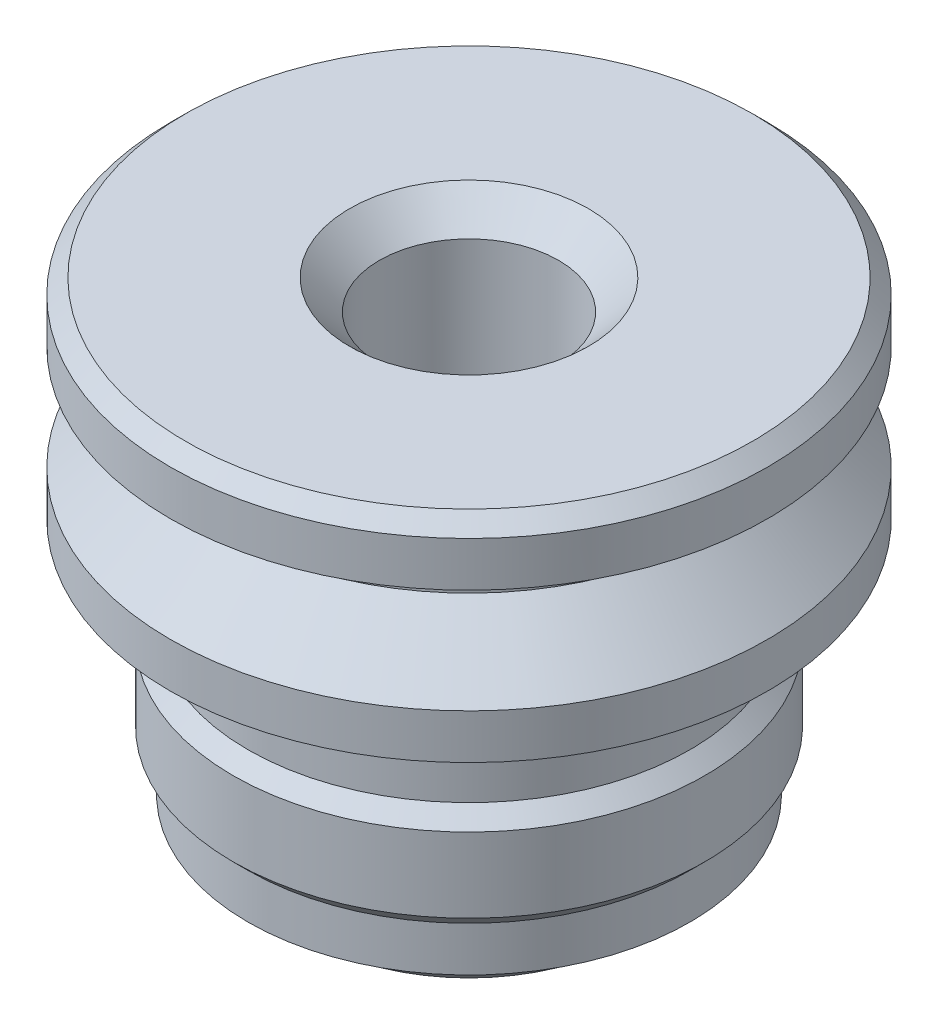
from build123d import *

# Parameters (mm, degrees)
CHAMFER_1_SIZE = 0.5
CHAMFER_2_SIZE = 1


with BuildPart() as part:
    # 스케치2 → 회전1 (revolve)
    with BuildSketch(Plane(origin=(0, 0, 0), x_dir=(0, 0, -1), z_dir=(1, 0, 0)), mode=Mode.PRIVATE) as revolve_1_sk:
        Polygon((3, 0), (10, 0), (10, -2), (8, -2), (8, -3.5), (10, -5.5), (10, -7), (7.4, -7), (7.4, -10), (7.9, -10.5), (7.9, -13), (7.4, -13.5), (7.4, -15), (5.9, -15), (5.9, -16.5), (3, -16.5), align=None)
    revolve(revolve_1_sk.sketch.rotate(Axis((0, 0, 0), (0, -1, 0)), 180), axis=Axis((0, 0, 0), (0, -1, 0)))

    # 모따기1
    chamfer_1_edges = [part.edges().sort_by_distance(p)[0] for p in [
        (0, 0, -10),
        (0, -16.5, -5.9),
    ]]
    chamfer(chamfer_1_edges, length=CHAMFER_1_SIZE)

    # 모따기2
    chamfer_2_edges = [part.edges().sort_by_distance(p)[0] for p in [
        (0, 0, -3),
    ]]
    chamfer(chamfer_2_edges, length=CHAMFER_2_SIZE)


solid = part.part
